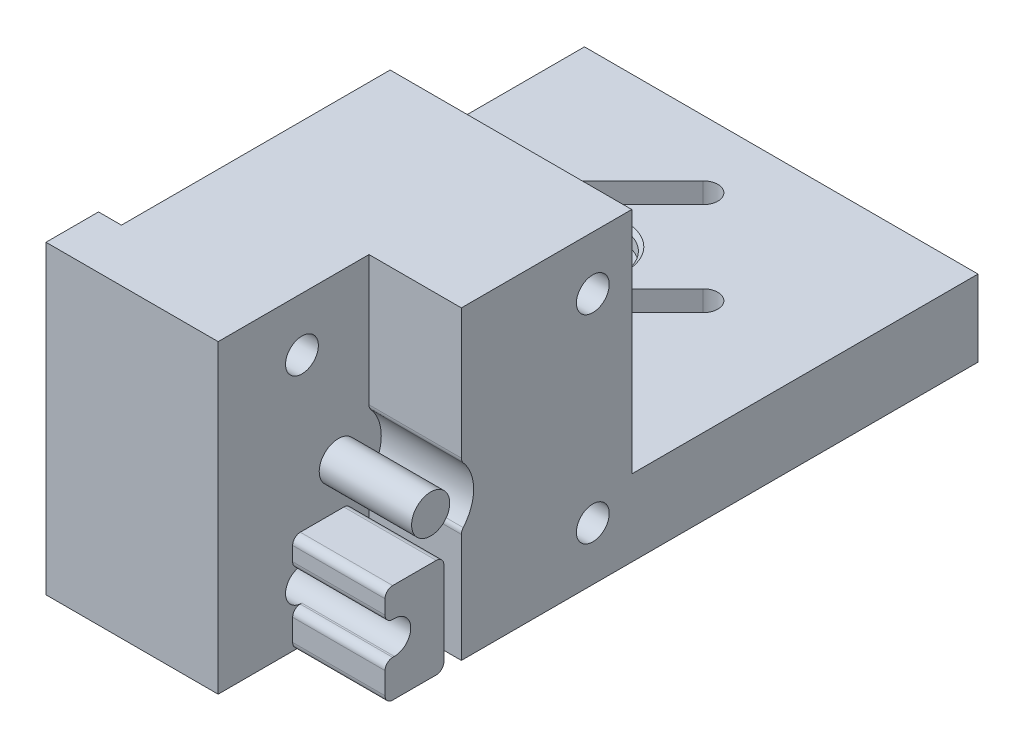
from build123d import *

# Parameters (mm, degrees)
SKETCH3_W             = 13.49028586
SKETCH3_H             = 10
BOSS_EXTRUDE1_DEPTH   = 22
SKETCH3_W_2           = 3
BOSS_EXTRUDE1_2_DEPTH = 22
BOSS_EXTRUDE1_3_DEPTH = 22
SKETCH4_W             = 27.150730292
SKETCH4_H             = 10
BOSS_EXTRUDE2_DEPTH   = 3
SKETCH5_W             = 27.150730292
SKETCH5_H             = 10
BOSS_EXTRUDE3_DEPTH   = 3
SKETCH7_W             = 12.1
SKETCH7_H             = 14.76
BOSS_EXTRUDE4_DEPTH   = 10
BOSS_EXTRUDE5_DEPTH   = 10
SKETCH15_R            = 1.915111108
CUT_EXTRUDE4_DEPTH    = 320.517471197
SKETCH18_W            = 12.1
SKETCH18_H            = 14.76
BOSS_EXTRUDE6_DEPTH   = 30
M4_CLEARANCE_HOLE1_D  = 4.3
CUT_EXTRUDE7_DEPTH    = 5
SKETCH17_R            = 5
CUT_EXTRUDE6_DEPTH    = 2
CHAMFER1_SIZE         = 0.5
SKETCH24_W            = 5
SKETCH24_H            = 40
CUT_EXTRUDE8_DEPTH    = 12.1
SKETCH25_R            = 2.5
BOSS_EXTRUDE10_DEPTH  = 12.1
CUT_EXTRUDE10_START   = -12.1
SKETCH31_R            = 5.628705003
SKETCH31_R_2          = 2.5
CUT_EXTRUDE10_DEPTH   = 12.1
FILLET1_R             = 1


with BuildPart() as part:
    # Sketch3 → Boss-Extrude1 (new body)
    with BuildSketch(Plane(origin=(-188.9, 0, 188.9), x_dir=(0.7071067811865475, 0, 0.7071067811865477), z_dir=(-0.7071067811865477, 0, 0.7071067811865475))):
        with Locations((0, -11.606969024)):
            Rectangle(SKETCH3_W, SKETCH3_H)
    extrude(amount=-BOSS_EXTRUDE1_DEPTH)



with BuildPart() as body_2:
    # Sketch3 → Boss-Extrude1 2 (new body)
    with BuildSketch(Plane(origin=(-188.9, 0, 188.9), x_dir=(0.7071067811865475, 0, 0.7071067811865477), z_dir=(-0.7071067811865477, 0, 0.7071067811865475))):
        with Locations((12.075365146, -11.606969024)):
            Rectangle(SKETCH3_W_2, SKETCH3_H)
    extrude(amount=-BOSS_EXTRUDE1_2_DEPTH)


with BuildPart() as body_3:
    # Sketch3 → Boss-Extrude1 3 (new body)
    with BuildSketch(Plane(origin=(-188.9, 0, 188.9), x_dir=(0.7071067811865475, 0, 0.7071067811865477), z_dir=(-0.7071067811865477, 0, 0.7071067811865475))):
        with Locations((-12.075365146, -11.606969024)):
            Rectangle(SKETCH3_W_2, SKETCH3_H)
    extrude(amount=-BOSS_EXTRUDE1_3_DEPTH)


with BuildPart() as part_1:
    add(part.part)

    add(body_2.part)  # Boss-Extrude2 merges body 2

    add(body_3.part)  # Boss-Extrude2 merges body 3
    # Sketch4 → Boss-Extrude2 (add)
    with BuildSketch(Plane(origin=(-188.9, 0, 188.9), x_dir=(0.7071067811865472, 0, 0.7071067811865479), z_dir=(-0.7071067811865479, 0, 0.7071067811865472))):
        with Locations((0, -11.606969024)):
            Rectangle(SKETCH4_W, SKETCH4_H)
    extrude(amount=BOSS_EXTRUDE2_DEPTH)

    # Sketch5 → Boss-Extrude3 (add)
    with BuildSketch(Plane(origin=(-173.343650814, 0, 173.343650814), x_dir=(-0.7071067811865472, 0, -0.7071067811865479), z_dir=(0.7071067811865479, 0, -0.7071067811865472))):
        with Locations((0, -11.606969024)):
            Rectangle(SKETCH5_W, SKETCH5_H)
    extrude(amount=BOSS_EXTRUDE3_DEPTH)

    # Sketch7 → Boss-Extrude4 (add)
    with BuildSketch(Plane(origin=(0, -6.606969024, 0), x_dir=(1, 0, 0), z_dir=(0, 1, 0))):
        Polygon((-183.9, -239), (-186.9, -239), (-186.9, -245.88), (-147.25, -245.88), (-147.25, -161.623097719), (-180.821563222, -161.623097719), (-161.623097719, -180.821563222), (-181.422087592, -200.620553095), (-200.620553095, -181.422087592), (-200.620553095, -203.8), (-183.9, -203.8), align=None)
        with Locations((-158.3, -233.5)):
            Rectangle(SKETCH7_W, SKETCH7_H, mode=Mode.SUBTRACT)
    extrude(amount=-BOSS_EXTRUDE4_DEPTH)

    # Sketch13 → Boss-Extrude5 (add)
    with BuildSketch(Plane(origin=(0, -6.606969024, 0), x_dir=(1, 0, 0), z_dir=(0, 1, 0))):
        Polygon((-203.8, -203.8), (-200.620553095, -203.8), (-200.620553095, -181.422087592), (-180.821563222, -161.623097719), (-147.25, -161.623097719), (-147.25, -158.443650814), (-203.8, -158.443650814), align=None)
    extrude(amount=-BOSS_EXTRUDE5_DEPTH)

    # Sketch15 → Cut-Extrude4 (cut, through all)
    with BuildSketch(Plane(origin=(0, -6.606969024, 0), x_dir=(1, 0, 0), z_dir=(0, 1, 0))):
        with Locations((-179.467375171, -167.219926457)):
            Circle(SKETCH15_R)
        with Locations((-167.219926457, -179.467375171)):
            Circle(SKETCH15_R)
        with Locations((-195.023724357, -182.776275643)):
            Circle(SKETCH15_R)
        with Locations((-182.776275643, -195.023724357)):
            Circle(SKETCH15_R)
    extrude(amount=-CUT_EXTRUDE4_DEPTH, mode=Mode.SUBTRACT)

    # Sketch18 → Boss-Extrude6 (add)
    with BuildSketch(Plane(origin=(0, -6.606969024, 0), x_dir=(1, 0, 0), z_dir=(0, 1, 0))):
        Polygon((-183.9, -203.8), (-147.25, -203.8), (-147.25, -245.88), (-186.9, -245.88), (-186.9, -239), (-183.9, -239), align=None)
        with Locations((-158.3, -233.5)):
            Rectangle(SKETCH18_W, SKETCH18_H, mode=Mode.SUBTRACT)
    extrude(amount=BOSS_EXTRUDE6_DEPTH)

    # M4 Clearance Hole1 (through all)
    with Locations(Plane(origin=(-147.25, 0, 0), x_dir=(0, 0, -1), z_dir=(1, 0, 0))):
        with Locations((-234.9, 16.393030976), (-208.9, -9.606969024), (-234.9, -9.606969024), (-208.9, 16.393030976)):
            Hole(M4_CLEARANCE_HOLE1_D / 2)

    # Sketch22 → Cut-Extrude7 (cut)
    with BuildSketch(Plane(origin=(-147.25, 0, 0), x_dir=(0, 0, -1), z_dir=(1, 0, 0))):
        Polygon((-245.88, 23.393030976), (-245.88, -16.606969024), (-158.443650814, -16.606969024), (-158.443650814, -6.606969024), (-203.8, -6.606969024), (-203.8, 23.393030976), align=None)
    extrude(amount=-CUT_EXTRUDE7_DEPTH, mode=Mode.SUBTRACT)

    # Sketch17 → Cut-Extrude6 (cut)
    with BuildSketch(Plane(origin=(0, -6.606969024, 0), x_dir=(1, 0, 0), z_dir=(0, 1, 0))):
        with Locations(Location((-181.121825407, -181.121825407, 0), (0, 0, 270))):
            Circle(SKETCH17_R)
    extrude(amount=-CUT_EXTRUDE6_DEPTH, mode=Mode.SUBTRACT)

    # Chamfer1
    chamfer1_edges = [part_1.edges().sort_by_distance(p)[0] for p in [
        (-181.121825407, -6.606969024, 176.121825407),
    ]]
    chamfer(chamfer1_edges, length=CHAMFER1_SIZE)

    # Sketch24 → Cut-Extrude8 (cut)
    with BuildSketch(Plane(origin=(-152.25, 0, 0), x_dir=(0, 0, -1), z_dir=(1, 0, 0))):
        with Locations((-243.38, 3.393030976)):
            Rectangle(SKETCH24_W, SKETCH24_H)
    extrude(amount=-CUT_EXTRUDE8_DEPTH, mode=Mode.SUBTRACT)

    # Sketch25 → Boss-Extrude10 (add)
    with BuildSketch(Plane(origin=(-164.35, 0, 0), x_dir=(0, 0, -1), z_dir=(1, 0, 0))):
        with Locations(Location((-230.14, 2.021735979, 0), (0, 0, 270))):
            Circle(SKETCH25_R)
        with BuildLine():
            Line((-228.41, -3.606969024), (-236.12, -3.606969024))
            Line((-236.12, -3.606969024), (-236.12, -7.456969024))
            Line((-236.12, -7.456969024), (-234.9, -7.456969024))
            ThreePointArc((-234.9, -7.456969024), (-232.75, -9.606969024), (-234.9, -11.756969024))
            Line((-234.9, -11.756969024), (-236.12, -11.756969024))
            Line((-236.12, -11.756969024), (-236.12, -16.606969024))
            Line((-236.12, -16.606969024), (-228.41, -16.606969024))
            Line((-228.41, -16.606969024), (-228.41, -3.606969024))
        make_face()
    extrude(amount=BOSS_EXTRUDE10_DEPTH)

    # Sketch31 → Cut-Extrude10 (cut)
    with BuildSketch(Plane(origin=(-152.25, 0, 0), x_dir=(0, 0, -1), z_dir=(1, 0, 0)).offset(CUT_EXTRUDE10_START)):
        with Locations((-230.14, 2.021735979)):
            Circle(SKETCH31_R)
        with Locations(Location((-230.14, 2.021735979, 0), (0, 0, 270))):
            Circle(SKETCH31_R_2, mode=Mode.SUBTRACT)
    extrude(amount=CUT_EXTRUDE10_DEPTH, mode=Mode.SUBTRACT)

    # Fillet1
    fillet1_edges = [part_1.edges().sort_by_distance(p)[0] for p in [
        (-158.3, -16.606969024, 228.41),
        (-158.3, -3.606969024, 228.41),
        (-158.3, -3.606969024, 236.12),
        (-158.3, -7.456969024, 236.12),
        (-158.3, -11.756969024, 236.12),
        (-158.3, -16.606969024, 236.12),
        (-158.3, 5.961522777, 226.12),
        (-158.3, -1.918050819, 226.12),
    ]]
    fillet(fillet1_edges, radius=FILLET1_R)


solid = part_1.part
